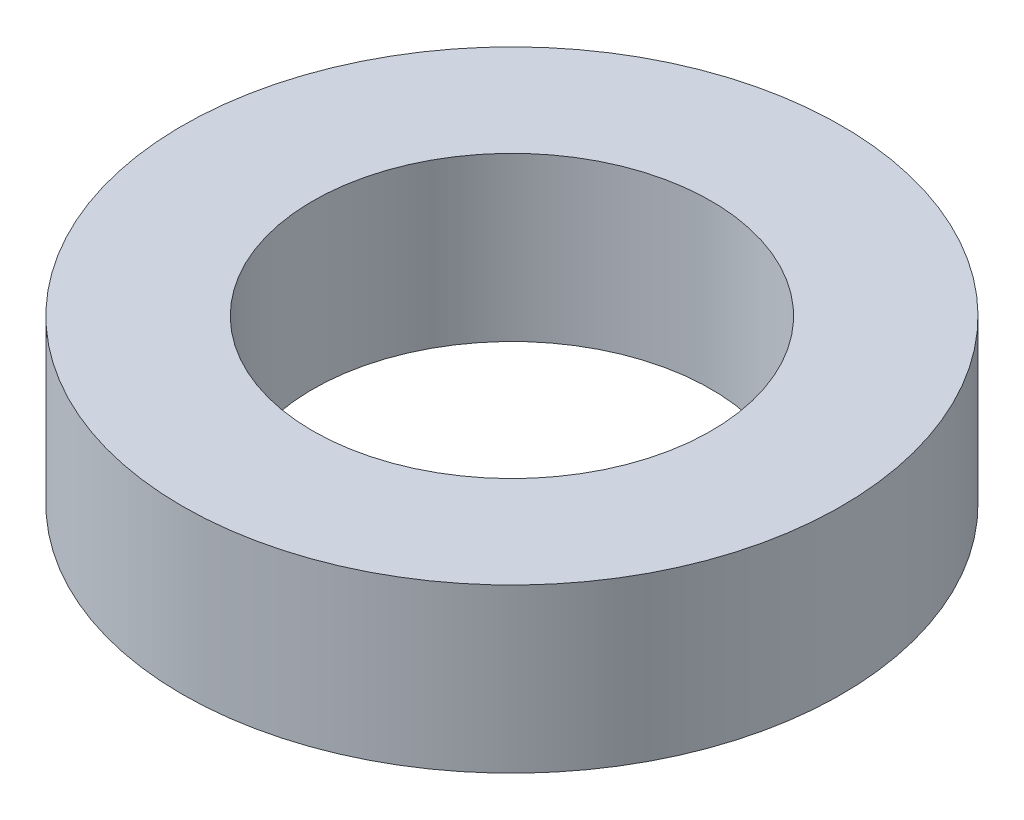
from build123d import *

# Parameters (mm, degrees)
SKETCH_1_R      = 18.2
SKETCH_1_R_2    = 11
EXTRUDE_1_DEPTH = 9


with BuildPart() as part:
    # Эскиз1 → Вытянуть1 (new body)
    with BuildSketch(Plane(origin=(0, 0, 0), x_dir=(1, 0, 0), z_dir=(0, 1, 0))):
        with Locations(Location((0, 0, 0), (0, 0, 270))):
            Circle(SKETCH_1_R)
        with Locations(Location((0, 0, 0), (0, 0, 270))):
            Circle(SKETCH_1_R_2, mode=Mode.SUBTRACT)
    extrude(amount=EXTRUDE_1_DEPTH)


solid = part.part
